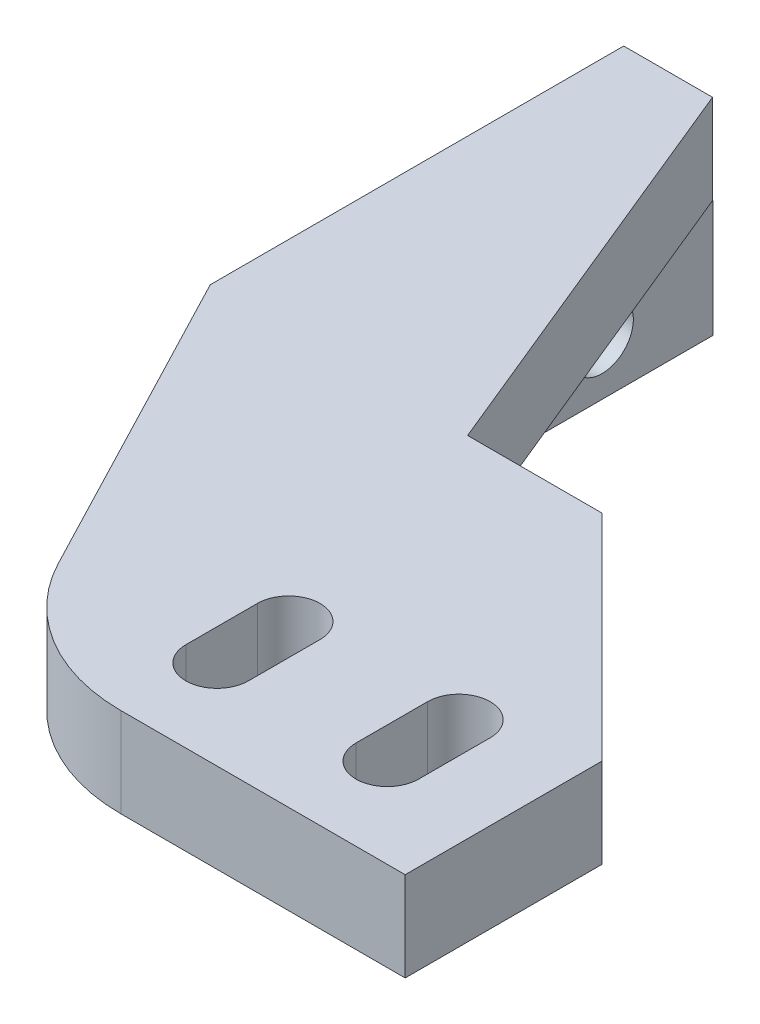
from build123d import *

# Parameters (mm, degrees)
ESTRUSIONE_ESTRUSIONE8_DEPTH = 5
SCHIZZO19_W                  = 5
SCHIZZO19_H                  = 46.212351189
ESTRUSIONE_ESTRUSIONE9_DEPTH = 6.5
SCHIZZO20_R                  = 1.75
TAGLIO_ESTRUSIONE9_DEPTH     = 6
TAGLIO_ESTRUSIONE13_DEPTH    = 21
SCHIZZO26_W                  = 5
SCHIZZO26_H                  = 6.5
TAGLIO_ESTRUSIONE15_DEPTH    = 21
RACCORDO1_R                  = 10
SMUSSO1_SIZE                 = 12


with BuildPart() as part:
    # Schizzo18 → Estrusione-Estrusione8 (new body)
    with BuildSketch(Plane(origin=(0, 40, 0), x_dir=(1, 0, 0), z_dir=(0, 1, 0))):
        Polygon((25, -16), (-9, -16), (-9, 30.212351189), (-4.036856652, 30.212351189), (5.487873038, 7), (25, 7), align=None)
        with BuildLine():
            Line((17.25, -11), (17.25, -7))
            ThreePointArc((17.25, -7), (19, -5.25), (20.75, -7))
            Line((20.75, -7), (20.75, -11))
            ThreePointArc((20.75, -11), (19, -12.75), (17.25, -11))
        make_face(mode=Mode.SUBTRACT)
        with BuildLine():
            Line((7.74056589, -11), (7.74056589, -7))
            ThreePointArc((7.74056589, -7), (9.49056589, -5.25), (11.24056589, -7))
            Line((11.24056589, -7), (11.24056589, -11))
            ThreePointArc((11.24056589, -11), (9.49056589, -12.75), (7.74056589, -11))
        make_face(mode=Mode.SUBTRACT)
    extrude(amount=ESTRUSIONE_ESTRUSIONE8_DEPTH)

    # Schizzo19 → Estrusione-Estrusione9 (add)
    with BuildSketch(Plane.XZ.offset(-40)):
        with Locations((-6.5, -7.106175595)):
            Rectangle(SCHIZZO19_W, SCHIZZO19_H)
    extrude(amount=ESTRUSIONE_ESTRUSIONE9_DEPTH)

    # Schizzo20 → Taglio-Estrusione9 (cut)
    with BuildSketch(Plane.ZY.offset(9)):
        with Locations((-24, 36.5)):
            Circle(SCHIZZO20_R)
        with Locations((-14, 36.5)):
            Circle(SCHIZZO20_R)
    extrude(amount=-TAGLIO_ESTRUSIONE9_DEPTH, mode=Mode.SUBTRACT)

    # Schizzo24 → Taglio-Estrusione13 (cut)
    with BuildSketch(Plane(origin=(0, 45, 0), x_dir=(1, 0, 0), z_dir=(0, 1, 0))):
        Polygon((3.042265575, -16), (-9, 7.106175595), (-9, -16), align=None)
    extrude(amount=-TAGLIO_ESTRUSIONE13_DEPTH, mode=Mode.SUBTRACT)

    # Schizzo26 → Taglio-Estrusione15 (cut)
    with BuildSketch(Plane.XY.offset(-7.106175595)):
        with Locations((-6.5, 36.75)):
            Rectangle(SCHIZZO26_W, SCHIZZO26_H)
    extrude(amount=TAGLIO_ESTRUSIONE15_DEPTH, mode=Mode.SUBTRACT)

    # Raccordo1
    raccordo1_edges = [part.edges().sort_by_distance(p)[0] for p in [
        (3.042265575, 42.5, 16),
    ]]
    fillet(raccordo1_edges, radius=RACCORDO1_R)

    # Smusso1
    smusso1_edges = [part.edges().sort_by_distance(p)[0] for p in [
        (25, 42.5, -7),
    ]]
    chamfer(smusso1_edges, length=SMUSSO1_SIZE)


solid = part.part
